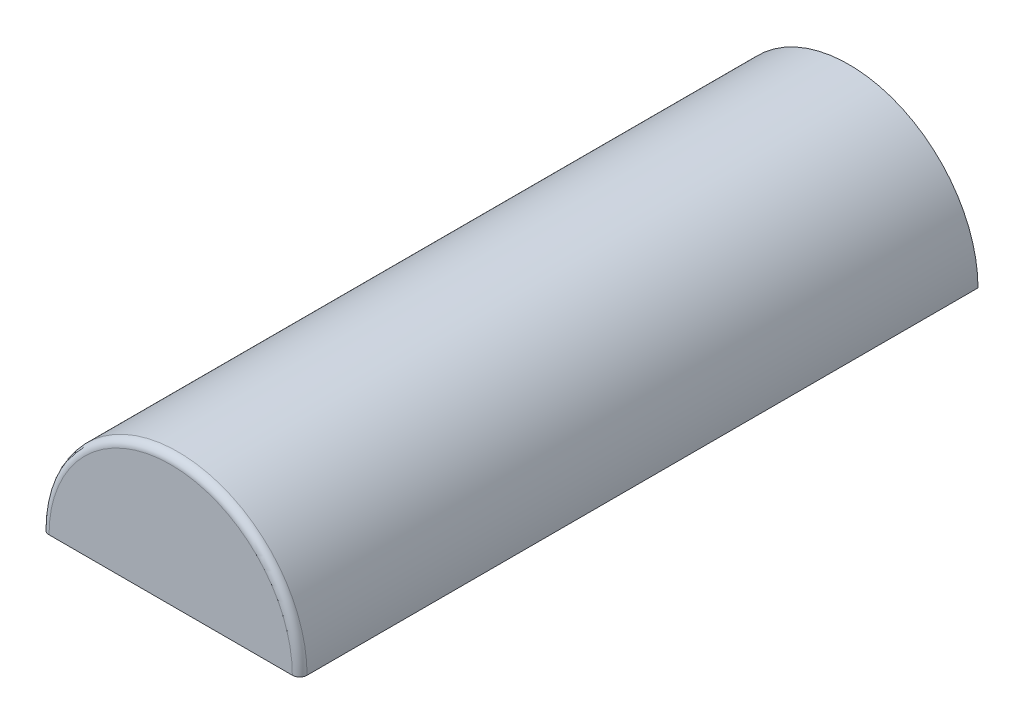
from build123d import *

# Parameters (mm, degrees)
EXTRUDE_1_DEPTH = 920
FILLET_1_R      = 10
SHELL_1_T       = -2


with BuildPart() as part:
    # 草图1 → 凸台-拉伸1 (new body)
    with BuildSketch(Plane.XY):
        with BuildLine():
            Line((-175, 0), (175, 0))
            ThreePointArc((175, 0), (0, 175), (-175, 0))
        make_face()
    extrude(amount=EXTRUDE_1_DEPTH)

    # 圆角1
    fillet_1_edges = [part.edges().sort_by_distance(p)[0] for p in [
        (0, 175, 920),
    ]]
    fillet(fillet_1_edges, radius=FILLET_1_R)

    # 抽壳1
    shell_1_openings = [part.faces().sort_by_distance(p)[0] for p in [
        (0, 0, 459.938974789),
    ]]
    offset(amount=SHELL_1_T, openings=shell_1_openings)


solid = part.part
